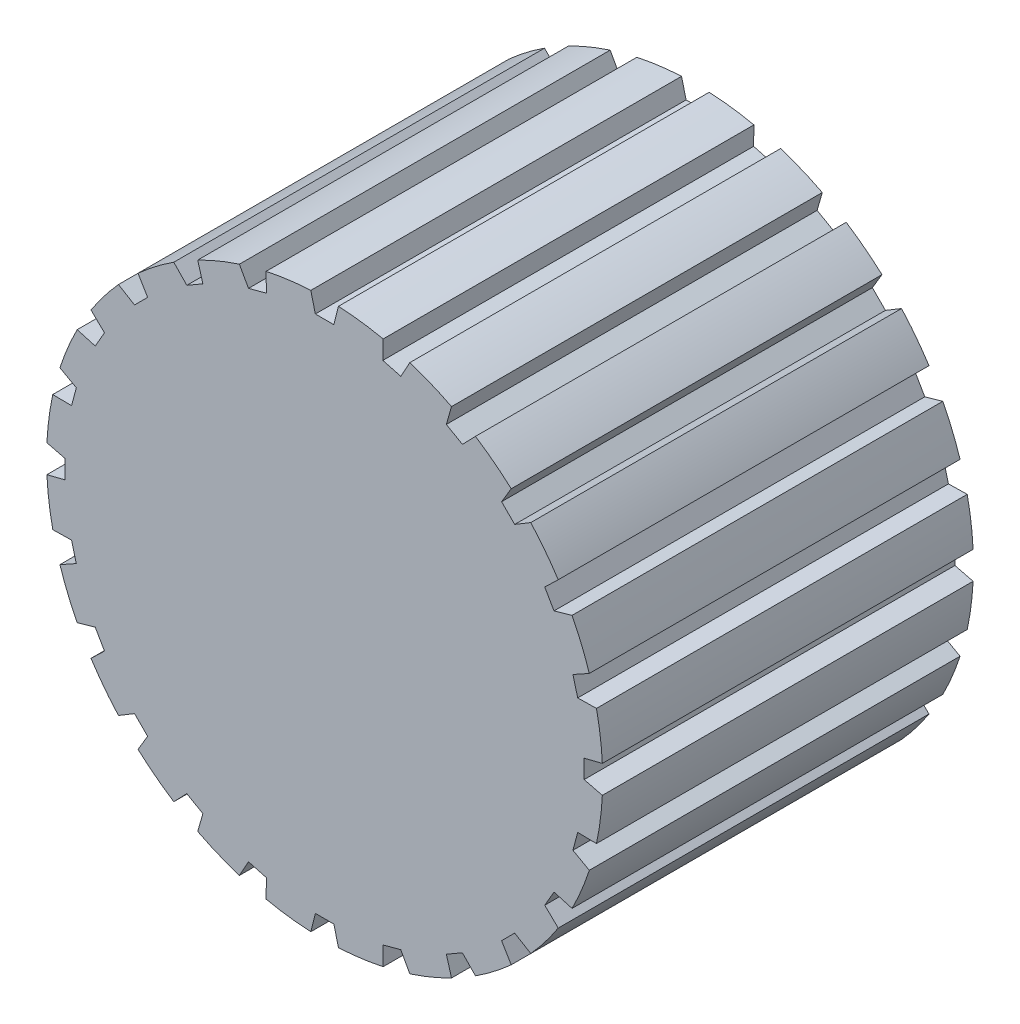
from build123d import *

# Parameters (mm, degrees)
SKETCH_1_R               = 1.5
EXTRUDE_1_DEPTH          = 1
CUT_EXTRUDE_1_DEPTH      = 4
PATTERN_CIRCULAR_1_COUNT = 24


with BuildPart() as part:
    # 草图1 → 凸台-拉伸1 (new, symmetric)
    with BuildSketch(Plane.XY):
        Circle(SKETCH_1_R)
    extrude(amount=EXTRUDE_1_DEPTH, both=True)

    # 草图2 → 切除-拉伸1 (cut)
    with BuildSketch(Plane.XY.offset(1)):
        Polygon((-0.075, 1.5), (-0.05, 1.4), (0.05, 1.4), (0.075, 1.5), align=None)
    cut_extrude_1 = extrude(amount=-CUT_EXTRUDE_1_DEPTH, mode=Mode.SUBTRACT)

    # 阵列(圆周)1: 切除-拉伸1 ×24 about axis
    pattern_circular_1_axis = Axis((0, 0, 0), (0, 0, 1))
    for i in range(1, PATTERN_CIRCULAR_1_COUNT):
        add(cut_extrude_1.rotate(pattern_circular_1_axis, i * 360 / PATTERN_CIRCULAR_1_COUNT), mode=Mode.SUBTRACT)


solid = part.part
